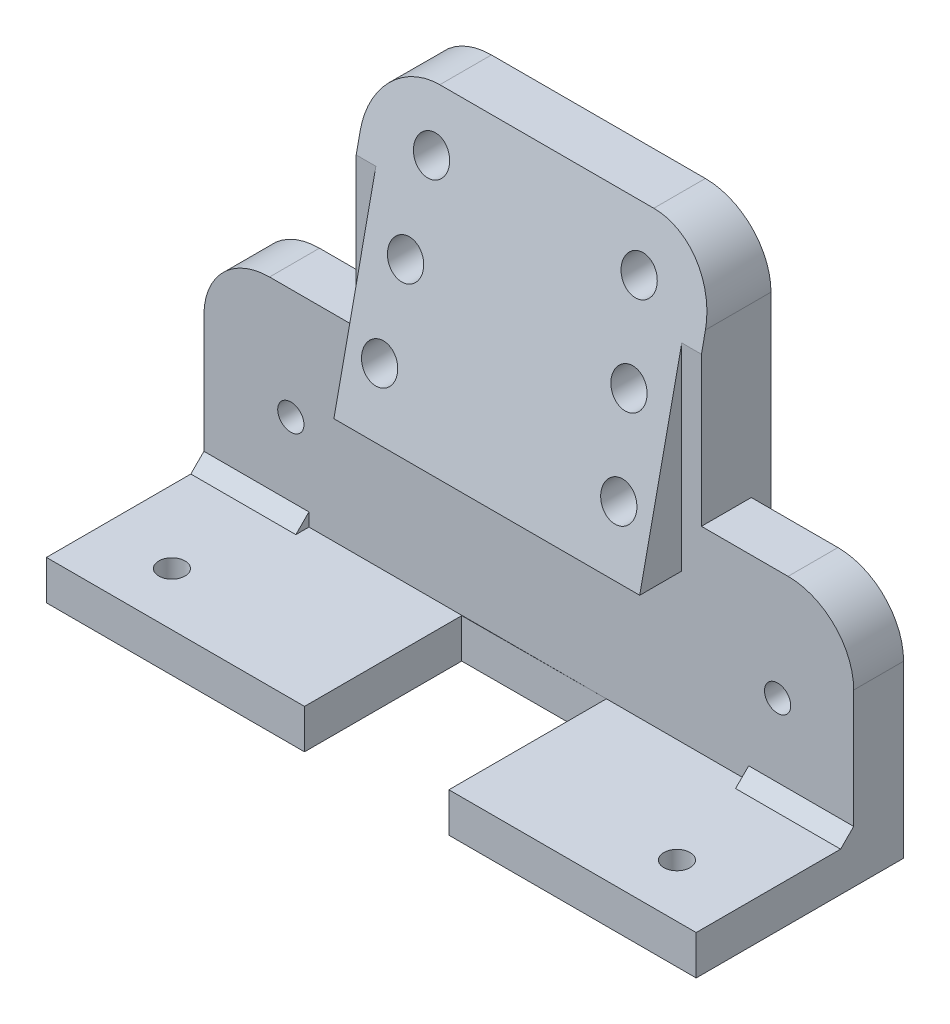
from build123d import *

# Parameters (mm, degrees)
RESSALTO_EXTRUS_O1_DEPTH          = 3.5
RESSALTO_EXTRUS_O2_DEPTH          = 1.8
ESBO_O5_W                         = 49.5
ESBO_O5_H                         = 3
RESSALTO_EXTRUS_O3_DEPTH          = 12
ESBO_O6_W                         = 1.5
ESBO_O6_H                         = 17.8
RESSALTO_EXTRUS_O4_DEPTH          = 1.8
ESBO_O7_R                         = 1
CORTE_EXTRUS_O2_DEPTH             = 45.583701426
CORTE_EXTRUS_O4_DEPTH             = 45.583701426
RESSALTO_EXTRUS_O5_DEPTH          = 8
RESSALTO_EXTRUS_O6_DEPTH          = 8
ESBO_O12_W                        = 11.60028147
ESBO_O12_H                        = 18
ESBO_O12_W_2                      = 11.59971853
RESSALTO_EXTRUS_O7_DEPTH          = 2
ESBO_O4_R                         = 1
CORTE_EXTRUS_O1_DEPTH             = 10
ESBO_O14_W                        = 23.3
ESBO_O14_H                        = 21.5
RESSALTO_EXTRUS_O8_DEPTH          = 5
CORTE_EXTRUS_O5_REACH             = 50.124
CORTE_EXTRUS_O5_DIRECTION_2_DEPTH = 10
CORTE_EXTRUS_O6_REACH             = 42.044
ESBO_O16_R                        = 1.35
FILETE1_R                         = 5


with BuildPart() as part:
    # Esboço1 → Ressalto-extrusão1 (new body)
    with BuildSketch(Plane.XY):
        Polygon((-13.15, -9.5), (13.15, -9.5), (13.15, 6.5), (13.15, 26.3), (-13.15, 26.3), (-13.15, 6.5), align=None)
    extrude(amount=RESSALTO_EXTRUS_O1_DEPTH)

    # Esboço2 → Ressalto-extrusão2 (add)
    with BuildSketch(Plane.XY.offset(3.5)):
        Polygon((24.75028147, 8.5), (11.65, 8.5), (11.65, 4.8), (-11.65, 4.8), (-11.65, 8.5), (-24.74971853, 8.5), (-24.74971853, -9.5), (-11.65, -9.5), (10.65, -9.5), (24.75028147, -9.5), align=None)
    extrude(amount=RESSALTO_EXTRUS_O2_DEPTH)

    # Esboço5 → Ressalto-extrusão3 (add)
    with BuildSketch(Plane.XY.offset(5.3)):
        with Locations((0.00028147, -8)):
            Rectangle(ESBO_O5_W, ESBO_O5_H)
    extrude(amount=RESSALTO_EXTRUS_O3_DEPTH)

    # Esboço6 → Ressalto-extrusão4 (add)
    with BuildSketch(Plane.XY.offset(3.5)):
        with Locations((-12.4, 17.4)):
            Rectangle(ESBO_O6_W, ESBO_O6_H)
        with Locations((12.4, 17.4)):
            Rectangle(ESBO_O6_W, ESBO_O6_H)
    extrude(amount=RESSALTO_EXTRUS_O4_DEPTH)

    # Esboço7 → Corte-extrusão2 (cut, through all)
    with BuildSketch(Plane(origin=(0, -6.5, 0), x_dir=(1, 0, 0), z_dir=(0, 1, 0))):
        with Locations((19.237396406, -13.252377825)):
            Circle(ESBO_O7_R)
        with Locations((-19.236833466, -13.252377825)):
            Circle(ESBO_O7_R)
    extrude(amount=-CORTE_EXTRUS_O2_DEPTH, mode=Mode.SUBTRACT)

    # Esboço9 → Corte-extrusão4 (cut, through all)
    with BuildSketch(Plane(origin=(0, -6.5, 0), x_dir=(1, 0, 0), z_dir=(0, 1, 0))):
        Polygon((-5.087829915, -5.323896898), (5.912170085, -5.3), (5.912170085, -14.390715249), (5.912170085, -17.3), (-5.087829915, -17.3), (-5.087829915, -14.390715249), align=None)
    extrude(amount=-CORTE_EXTRUS_O4_DEPTH, mode=Mode.SUBTRACT)

    # Esboço10 → Ressalto-extrusão5 (add)
    with BuildSketch(Plane(origin=(24.75028147, 0, 0), x_dir=(0, 0, -1), z_dir=(1, 0, 0))):
        Polygon((-6.3, -6.5), (-5.3, -6.5), (-5.3, -5.5), align=None)
    extrude(amount=-RESSALTO_EXTRUS_O5_DEPTH)

    # Esboço11 → Ressalto-extrusão6 (add)
    with BuildSketch(Plane.ZY.offset(24.74971853)):
        Polygon((5.3, -5.5), (6.3, -6.5), (5.3, -6.5), align=None)
    extrude(amount=-RESSALTO_EXTRUS_O6_DEPTH)

    # Esboço12 → Ressalto-extrusão7 (add)
    with BuildSketch(Plane(origin=(0, 0, 3.5), x_dir=(-1, 0, 0), z_dir=(0, 0, -1))):
        with Locations((-18.950140735, -0.5)):
            Rectangle(ESBO_O12_W, ESBO_O12_H)
        with Locations((18.949859265, -0.5)):
            Rectangle(ESBO_O12_W_2, ESBO_O12_H)
    extrude(amount=RESSALTO_EXTRUS_O7_DEPTH)

    # Esboço4 → Corte-extrusão1 (cut)
    with BuildSketch(Plane.XY.offset(5.3)):
        with Locations((-18.129829915, 0.0659)):
            Circle(ESBO_O4_R)
        with Locations((18.954170085, 0.0659)):
            Circle(ESBO_O4_R)
    extrude(amount=-CORTE_EXTRUS_O1_DEPTH, mode=Mode.SUBTRACT)

    # Esboço14 → Ressalto-extrusão8 (add)
    with BuildSketch(Plane.XY.offset(3.5)):
        with Locations((0, 15.55)):
            Rectangle(ESBO_O14_W, ESBO_O14_H)
    extrude(amount=RESSALTO_EXTRUS_O8_DEPTH)

    # Esboço15 → Corte-extrusão5 (cut, up to next)
    with BuildSketch(Plane(origin=(11.65, 0, 0), x_dir=(0, 0, -1), z_dir=(1, 0, 0)), mode=Mode.PRIVATE) as corte_extrus_o5_sk1:
        Polygon((-8.5, 26.3), (-8.5, 4.8), (-3.930033924, 26.3), align=None)
    corte_extrus_o5_tool1 = extrude(corte_extrus_o5_sk1.sketch, amount=-CORTE_EXTRUS_O5_REACH, mode=Mode.PRIVATE) & part.part
    add(corte_extrus_o5_tool1.solids().sort_by_distance((11.65, 19.133333, 6.976678))[0], mode=Mode.SUBTRACT)

    # Esboço15 → Corte-extrusão5 direction 2 (cut)
    with BuildSketch(Plane(origin=(11.65, 0, 0), x_dir=(0, 0, -1), z_dir=(1, 0, 0))):
        Polygon((-8.5, 26.3), (-8.5, 4.8), (-3.930033924, 26.3), align=None)
    extrude(amount=CORTE_EXTRUS_O5_DIRECTION_2_DEPTH, mode=Mode.SUBTRACT)

    # Esboço16 → Corte-extrusão6 (cut, up to next)
    with BuildSketch(Plane(origin=(0, 0, 0), x_dir=(-1, 0, 0), z_dir=(0, 0, -1)), mode=Mode.PRIVATE) as corte_extrus_o6_sk1:
        with Locations((7.908, 22.199)):
            Circle(ESBO_O16_R)
    corte_extrus_o6_tool1 = extrude(corte_extrus_o6_sk1.sketch, amount=-CORTE_EXTRUS_O6_REACH, mode=Mode.PRIVATE) & part.part
    # Esboço16 → Corte-extrusão6 (cut, up to next)
    with BuildSketch(Plane(origin=(0, 0, 0), x_dir=(-1, 0, 0), z_dir=(0, 0, -1)), mode=Mode.PRIVATE) as corte_extrus_o6_sk2:
        with Locations((-9.11, 9.245)):
            Circle(ESBO_O16_R)
    corte_extrus_o6_tool2 = extrude(corte_extrus_o6_sk2.sketch, amount=-CORTE_EXTRUS_O6_REACH, mode=Mode.PRIVATE) & part.part
    # Esboço16 → Corte-extrusão6 (cut, up to next)
    with BuildSketch(Plane(origin=(0, 0, 0), x_dir=(-1, 0, 0), z_dir=(0, 0, -1)), mode=Mode.PRIVATE) as corte_extrus_o6_sk3:
        with Locations((9.11, 9.245)):
            Circle(ESBO_O16_R)
    corte_extrus_o6_tool3 = extrude(corte_extrus_o6_sk3.sketch, amount=-CORTE_EXTRUS_O6_REACH, mode=Mode.PRIVATE) & part.part
    # Esboço16 → Corte-extrusão6 (cut, up to next)
    with BuildSketch(Plane(origin=(0, 0, 0), x_dir=(-1, 0, 0), z_dir=(0, 0, -1)), mode=Mode.PRIVATE) as corte_extrus_o6_sk4:
        with Locations((-7.908, 22.199)):
            Circle(ESBO_O16_R)
    corte_extrus_o6_tool4 = extrude(corte_extrus_o6_sk4.sketch, amount=-CORTE_EXTRUS_O6_REACH, mode=Mode.PRIVATE) & part.part
    # Esboço16 → Corte-extrusão6 (cut, up to next)
    with BuildSketch(Plane(origin=(0, 0, 0), x_dir=(-1, 0, 0), z_dir=(0, 0, -1)), mode=Mode.PRIVATE) as corte_extrus_o6_sk5:
        with Locations((-8.509, 15.722)):
            Circle(ESBO_O16_R)
    corte_extrus_o6_tool5 = extrude(corte_extrus_o6_sk5.sketch, amount=-CORTE_EXTRUS_O6_REACH, mode=Mode.PRIVATE) & part.part
    # Esboço16 → Corte-extrusão6 (cut, up to next)
    with BuildSketch(Plane(origin=(0, 0, 0), x_dir=(-1, 0, 0), z_dir=(0, 0, -1)), mode=Mode.PRIVATE) as corte_extrus_o6_sk6:
        with Locations((8.509, 15.722)):
            Circle(ESBO_O16_R)
    corte_extrus_o6_tool6 = extrude(corte_extrus_o6_sk6.sketch, amount=-CORTE_EXTRUS_O6_REACH, mode=Mode.PRIVATE) & part.part
    add(corte_extrus_o6_tool1.solids().sort_by_distance((-7.908, 22.199, 0))[0], mode=Mode.SUBTRACT)
    add(corte_extrus_o6_tool2.solids().sort_by_distance((9.11, 9.245, 0))[0], mode=Mode.SUBTRACT)
    add(corte_extrus_o6_tool3.solids().sort_by_distance((-9.11, 9.245, 0))[0], mode=Mode.SUBTRACT)
    add(corte_extrus_o6_tool4.solids().sort_by_distance((7.908, 22.199, 0))[0], mode=Mode.SUBTRACT)
    add(corte_extrus_o6_tool5.solids().sort_by_distance((8.509, 15.722, 0))[0], mode=Mode.SUBTRACT)
    add(corte_extrus_o6_tool6.solids().sort_by_distance((-8.509, 15.722, 0))[0], mode=Mode.SUBTRACT)

    # Filete1
    filete1_edges = [part.edges().sort_by_distance(p)[0] for p in [
        (24.75028147, 8.5, 3.4),
        (-24.74971853, 8.5, 3.4),
        (-13.15, 26.3, 1.965016962),
        (13.15, 26.3, 1.965016962),
    ]]
    fillet(filete1_edges, radius=FILETE1_R)


solid = part.part
